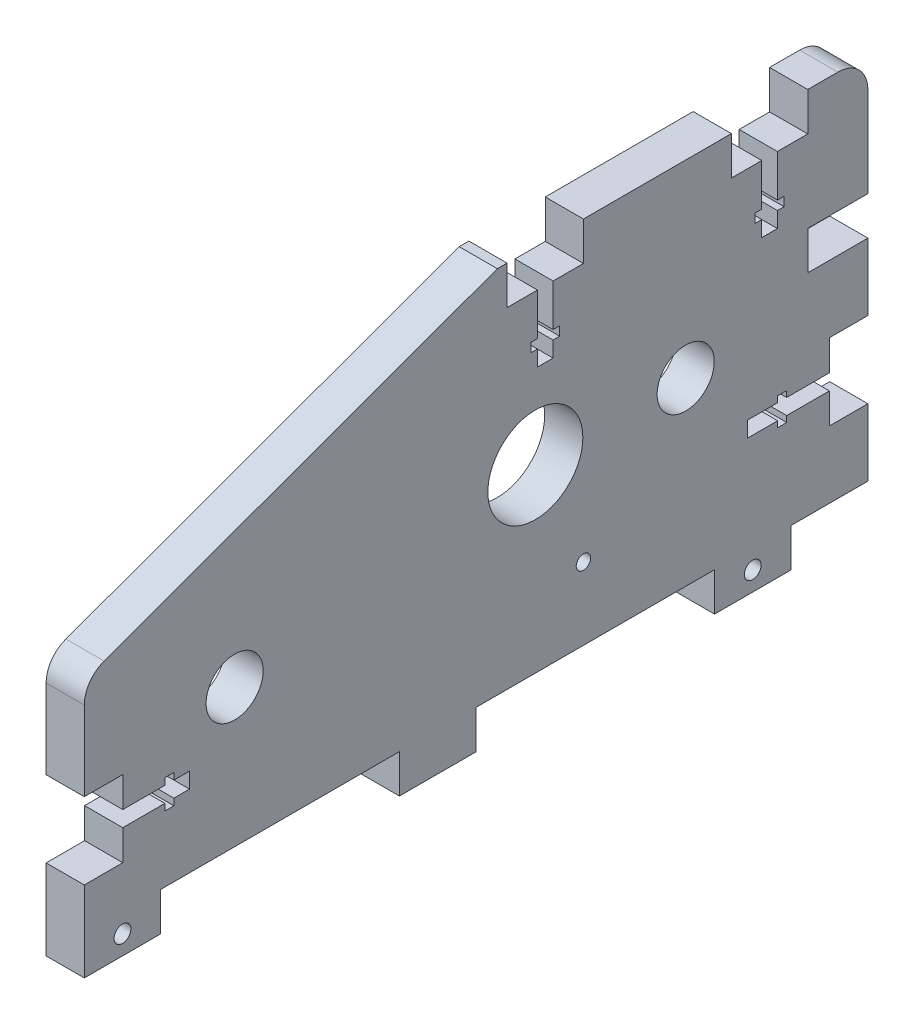
from build123d import *

# Parameters (mm, degrees)
SKETCH2_R              = 1.4
BOSS_EXTRUDE1_DEPTH    = 6.35
SKETCH3_R              = 4.75
SKETCH3_R_2            = 7.9
AXII_DEPTH             = 76.241311791
CHAMFER1_SIZE          = 25
CHAMFER1_SIZE2         = 68.686935486
FILLET1_R              = 5
PLATEATTACHMENTS_DEPTH = 76.241311791
SKETCH6_R              = 1.2
WIREGUIDE_DEPTH        = 76.241311791


with BuildPart() as part:
    # Sketch2 → Boss-Extrude1 (new body)
    with BuildSketch(Plane(origin=(0, 0, 0), x_dir=(0, 0, -1), z_dir=(1, 0, 0))):
        Polygon((52.35, -30.7), (65.15, -30.7), (65.15, -19.55), (58.75, -19.55), (58.75, -14.5), (51.65, -14.5), (51.65, -15.5), (50.15, -15.5), (50.15, -14.5), (45.15, -14.5), (45.15, -11.9), (50.15, -11.9), (50.15, -10.9), (51.65, -10.9), (51.65, -11.9), (58.75, -11.9), (58.75, -6.85), (65.15, -6.85), (65.15, 4.3), (55.15, 4.3), (55.15, 10.7), (65.15, 10.7), (65.15, 30.7), (-65.15, 30.7), (-65.15, -30.7), (-65.15, -37.1), (-52.45, -37.1), (-52.45, -30.7), (-12.75, -30.7), (-12.75, -37.1), (-0.05, -37.1), (-0.05, -30.7), (39.65, -30.7), (39.65, -37.1), (52.35, -37.1), align=None)
        with Locations((-58.8, -33.9)):
            Circle(SKETCH2_R, mode=Mode.SUBTRACT)
        with Locations((46, -33.9)):
            Circle(SKETCH2_R, mode=Mode.SUBTRACT)
    extrude(amount=BOSS_EXTRUDE1_DEPTH)

    # Sketch3 → Axii (cut, through all)
    with BuildSketch(Plane(origin=(6.35, 0, 0), x_dir=(0, 0, -1), z_dir=(1, 0, 0))):
        with Locations((-40.15, -7.7)):
            Circle(SKETCH3_R)
        with Locations((34.85, -0.7)):
            Circle(SKETCH3_R)
        with Locations((9.85, -0.7)):
            Circle(SKETCH3_R_2)
    extrude(amount=-AXII_DEPTH, mode=Mode.SUBTRACT)

    # Chamfer1
    chamfer1_edges = [part.edges().sort_by_distance(p)[0] for p in [
        (3.175, 30.7, 65.15),
    ]]
    chamfer1_side = [part.faces().sort_by_distance(p)[0] for p in [
        (3.175, -3.2, 65.15),
    ]]
    chamfer(chamfer1_edges, length=CHAMFER1_SIZE, length2=CHAMFER1_SIZE2, reference=chamfer1_side[0])

    # Fillet1
    fillet1_edges = [part.edges().sort_by_distance(p)[0] for p in [
        (3.175, 5.7, 65.15),
        (3.175, 30.7, -65.15),
    ]]
    fillet(fillet1_edges, radius=FILLET1_R)

    # Sketch5 → PlateAttachments (cut, through all)
    with BuildSketch(Plane(origin=(6.35, 0, 0), x_dir=(0, 0, -1), z_dir=(1, 0, 0))):
        Polygon((55.15, 24.3), (55.15, 30.7), (42.45, 30.7), (42.45, 24.3), (47.5, 24.3), (47.5, 17.3), (46.4, 17.3), (46.4, 15.8), (47.5, 15.8), (47.5, 13.2), (50.1, 13.2), (50.1, 15.8), (51.2, 15.8), (51.2, 17.3), (50.1, 17.3), (50.1, 24.3), align=None)
        Polygon((17.85, 30.7), (5.15, 30.7), (5.15, 24.3), (10.2, 24.3), (10.2, 17.3), (9.1, 17.3), (9.1, 15.8), (10.2, 15.8), (10.2, 13.2), (12.8, 13.2), (12.8, 15.8), (13.9, 15.8), (13.9, 17.3), (12.8, 17.3), (12.8, 24.3), (17.85, 24.3), align=None)
        Polygon((-58.75, -11), (-65.15, -11), (-65.15, -23.7), (-58.75, -23.7), (-58.75, -18.65), (-51.75, -18.65), (-51.75, -19.75), (-50.25, -19.75), (-50.25, -18.65), (-47.65, -18.65), (-47.65, -16.05), (-50.25, -16.05), (-50.25, -14.95), (-51.75, -14.95), (-51.75, -16.05), (-58.75, -16.05), align=None)
    extrude(amount=-PLATEATTACHMENTS_DEPTH, mode=Mode.SUBTRACT)

    # Sketch6 → WireGuide (cut, through all)
    with BuildSketch(Plane(origin=(6.35, 0, 0), x_dir=(0, 0, -1), z_dir=(1, 0, 0))):
        with Locations((17.85, -18.7)):
            Circle(SKETCH6_R)
    extrude(amount=-WIREGUIDE_DEPTH, mode=Mode.SUBTRACT)


solid = part.part
